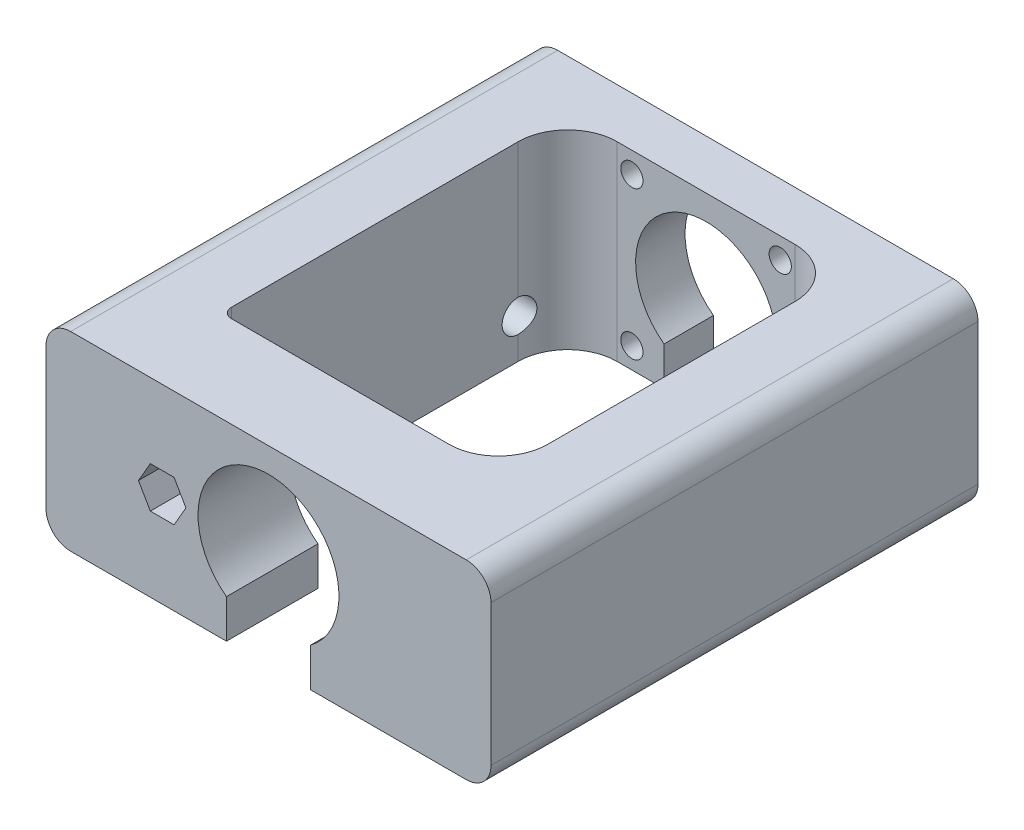
from build123d import *

# Parameters (mm, degrees)
SKETCH1_R               = 2.25
BOSS_EXTRUDE1_DEPTH     = 10
BOSS_EXTRUDE3_DEPTH     = 70
BOSS_EXTRUDE3_2_DEPTH   = 70
SKETCH4_R               = 3.5
BOSS_EXTRUDE4_DEPTH     = 10
BOSS_EXTRUDE5_DEPTH     = 8.5
FILLET2_R               = 2
FILLET3_R               = 10
CUT_EXTRUDE1_DEPTH      = 10
CUT_EXTRUDE1_DEPTH_BACK = 125.104039016
SKETCH7_R               = 3.25


with BuildPart() as part:
    # Sketch1 → Boss-Extrude1 (new body)
    with BuildSketch(Plane.XY):
        with BuildLine():
            Line((15, 19.25), (-15, 19.25))
            Line((-15, 19.25), (-30, 19.25))
            Line((-30, 19.25), (-40, 19.25))
            ThreePointArc((-40, 19.25), (-43.535533906, 17.785533906), (-45, 14.25))
            Line((-45, 14.25), (-45, -14.25))
            ThreePointArc((-45, -14.25), (-43.535533906, -17.785533906), (-40, -19.25))
            Line((-40, -19.25), (-30, -19.25))
            Line((-30, -19.25), (-15, -19.25))
            Line((-15, -19.25), (-8.5, -19.25))
            Line((-8.5, -19.25), (-8.5, -16.75))
            Line((-8.5, -16.75), (-8.5, -11.437329234))
            ThreePointArc((-8.5, -11.437329234), (0, 14.25), (8.5, -11.437329234))
            Line((8.5, -11.437329234), (8.5, -16.75))
            Line((8.5, -16.75), (8.5, -19.25))
            Line((8.5, -19.25), (15, -19.25))
            Line((15, -19.25), (30, -19.25))
            Line((30, -19.25), (40, -19.25))
            ThreePointArc((40, -19.25), (43.535533906, -17.785533906), (45, -14.25))
            Line((45, -14.25), (45, 14.25))
            ThreePointArc((45, 14.25), (43.535533906, 17.785533906), (40, 19.25))
            Line((40, 19.25), (30, 19.25))
            Line((30, 19.25), (15, 19.25))
        make_face()
        with Locations((-15, -15)):
            Circle(SKETCH1_R, mode=Mode.SUBTRACT)
        with Locations((15, -15)):
            Circle(SKETCH1_R, mode=Mode.SUBTRACT)
        with Locations((-15, 15)):
            Circle(SKETCH1_R, mode=Mode.SUBTRACT)
        with Locations((15, 15)):
            Circle(SKETCH1_R, mode=Mode.SUBTRACT)
    extrude(amount=BOSS_EXTRUDE1_DEPTH)


with BuildPart() as body_2:
    # Sketch2 → Boss-Extrude3 (new body)
    with BuildSketch(Plane.XY.offset(10)):
        with BuildLine():
            Line((-45, 14.25), (-45, -14.25))
            ThreePointArc((-45, -14.25), (-43.535533906, -17.785533906), (-40, -19.25))
            Line((-40, -19.25), (-28, -19.25))
            Line((-28, -19.25), (-28, 0))
            Line((-28, 0), (-28, 19.25))
            Line((-28, 19.25), (-40, 19.25))
            ThreePointArc((-40, 19.25), (-43.535533906, 17.785533906), (-45, 14.25))
        make_face()
    extrude(amount=BOSS_EXTRUDE3_DEPTH)

    # Sketch4 → Boss-Extrude4 (add)
    with BuildSketch(Plane.XY.offset(80)):
        with BuildLine():
            Line((-45, 14.25), (-45, -14.25))
            ThreePointArc((-45, -14.25), (-43.535533906, -17.785533906), (-40, -19.25))
            Line((-40, -19.25), (-8.5, -19.25))
            Line((-8.5, -19.25), (-8.5, -11.437329234))
            ThreePointArc((-8.5, -11.437329234), (0, 14.25), (8.5, -11.437329234))
            Line((8.5, -11.437329234), (8.5, -19.25))
            Line((8.5, -19.25), (40, -19.25))
            ThreePointArc((40, -19.25), (43.535533906, -17.785533906), (45, -14.25))
            Line((45, -14.25), (45, 14.25))
            ThreePointArc((45, 14.25), (43.535533906, 17.785533906), (40, 19.25))
            Line((40, 19.25), (-40, 19.25))
            ThreePointArc((-40, 19.25), (-43.535533906, 17.785533906), (-45, 14.25))
        make_face()
        with Locations((-21.5, 0)):
            Circle(SKETCH4_R, mode=Mode.SUBTRACT)
    extrude(amount=BOSS_EXTRUDE4_DEPTH)

    # Sketch6 → Boss-Extrude5 (add)
    with BuildSketch(Plane.XY.offset(90)):
        with BuildLine():
            Line((-40, -19.25), (-8.5, -19.25))
            Line((-8.5, -19.25), (-8.5, -11.437329234))
            ThreePointArc((-8.5, -11.437329234), (0, 14.25), (8.5, -11.437329234))
            Line((8.5, -11.437329234), (8.5, -19.25))
            Line((8.5, -19.25), (40, -19.25))
            ThreePointArc((40, -19.25), (43.535533906, -17.785533906), (45, -14.25))
            Line((45, -14.25), (45, 14.25))
            ThreePointArc((45, 14.25), (43.535533906, 17.785533906), (40, 19.25))
            Line((40, 19.25), (-40, 19.25))
            ThreePointArc((-40, 19.25), (-43.535533906, 17.785533906), (-45, 14.25))
            Line((-45, 14.25), (-45, -14.25))
            ThreePointArc((-45, -14.25), (-43.535533906, -17.785533906), (-40, -19.25))
        make_face()
        Polygon((-16.7, 0), (-19.1, 4.156921938), (-23.9, 4.156921938), (-26.3, 0), (-23.9, -4.156921938), (-19.1, -4.156921938), align=None, mode=Mode.SUBTRACT)
    extrude(amount=BOSS_EXTRUDE5_DEPTH)


with BuildPart() as body_3:
    # Sketch2 → Boss-Extrude3 2 (new body)
    with BuildSketch(Plane.XY.offset(10)):
        with BuildLine():
            Line((40, -19.25), (28, -19.25))
            Line((28, -19.25), (28, 0))
            Line((28, 0), (28, 19.25))
            Line((28, 19.25), (40, 19.25))
            ThreePointArc((40, 19.25), (43.535533906, 17.785533906), (45, 14.25))
            Line((45, 14.25), (45, -14.25))
            ThreePointArc((45, -14.25), (43.535533906, -17.785533906), (40, -19.25))
        make_face()
    extrude(amount=BOSS_EXTRUDE3_2_DEPTH)


with BuildPart() as part_1:
    add(part.part)

    # Combine1: union body 2, body 3
    add(body_2.part)
    add(body_3.part)

    # Fillet2
    fillet2_edges = [part_1.edges().sort_by_distance(p)[0] for p in [
        (-28, 0, 80),
    ]]
    fillet(fillet2_edges, radius=FILLET2_R)

    # Fillet3
    fillet3_edges = [part_1.edges().sort_by_distance(p)[0] for p in [
        (28, 0, 80),
        (-28, 0, 10),
        (28, 0, 10),
    ]]
    fillet(fillet3_edges, radius=FILLET3_R)

    # Sketch7 → Cut-Extrude1 (cut, two sides: drawn at the far end of the back side and taken through both)
    with BuildSketch(Plane(origin=(-28, 0, 0), x_dir=(0, 0, -1), z_dir=(1, 0, 0)).offset(-CUT_EXTRUDE1_DEPTH_BACK)):
        with Locations(Location((-20, -11.25, 0), (0, 0, 247.380135052))):
            Circle(SKETCH7_R)
    extrude(amount=CUT_EXTRUDE1_DEPTH + CUT_EXTRUDE1_DEPTH_BACK, mode=Mode.SUBTRACT)


solid = part_1.part
